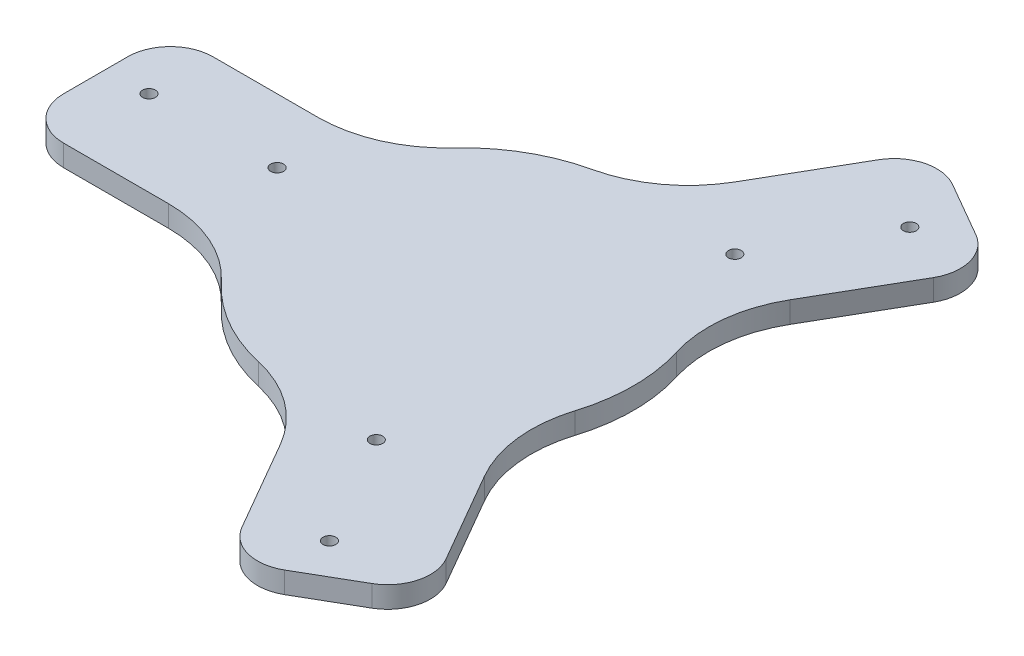
from build123d import *

# Parameters (mm, degrees)
ESQUISSE1_R        = 1.5
BOSS_EXTRU_1_DEPTH = 5


with BuildPart() as part:
    # Esquisse1 → Boss.-Extru.1 (new body)
    with BuildSketch(Plane(origin=(0, 0, 0), x_dir=(1, 0, 0), z_dir=(0, 1, 0))):
        with BuildLine():
            Line((40.864149318, 35.778782826), (53.139812779, 57.040855637))
            ThreePointArc((53.139812779, 57.040855637), (54.138817004, 64.629046088), (49.479558741, 70.701109675))
            Line((49.479558741, 70.701109675), (36.489177684, 78.201109675))
            ThreePointArc((36.489177684, 78.201109675), (28.900987233, 79.2001139), (22.828923646, 74.540855637))
            Line((22.828923646, 74.540855637), (10.553260185, 53.278782826))
            ThreePointArc((10.553260185, 53.278782826), (2.360755727, 44.121425984), (-8.815715388, 39.016447329))
            ThreePointArc((-8.815715388, 39.016447329), (-20, 34.641016151), (-29.381376859, 27.142857143))
            ThreePointArc((-29.381376859, 27.142857143), (-39.390653617, 20.016238561), (-51.417409503, 17.5))
            Line((-51.417409503, 17.5), (-75.968736425, 17.5))
            ThreePointArc((-75.968736425, 17.5), (-83.039804237, 14.571067812), (-85.968736425, 7.5))
            Line((-85.968736425, 7.5), (-85.968736425, -7.5))
            ThreePointArc((-85.968736425, -7.5), (-83.039804237, -14.571067812), (-75.968736425, -17.5))
            Line((-75.968736425, -17.5), (-51.417409503, -17.5))
            ThreePointArc((-51.417409503, -17.5), (-39.390653617, -20.016238561), (-29.381376859, -27.142857143))
            ThreePointArc((-29.381376859, -27.142857143), (-20, -34.641016151), (-8.815715388, -39.016447329))
            ThreePointArc((-8.815715388, -39.016447329), (2.360755727, -44.121425984), (10.553260185, -53.278782826))
            Line((10.553260185, -53.278782826), (22.828923646, -74.540855637))
            ThreePointArc((22.828923646, -74.540855637), (28.900987233, -79.2001139), (36.489177684, -78.201109675))
            Line((36.489177684, -78.201109675), (49.479558741, -70.701109675))
            ThreePointArc((49.479558741, -70.701109675), (54.138817004, -64.629046088), (53.139812779, -57.040855637))
            Line((53.139812779, -57.040855637), (40.864149318, -35.778782826))
            ThreePointArc((40.864149318, -35.778782826), (37.02989789, -24.105187424), (38.197092246, -11.873590187))
            ThreePointArc((38.197092246, -11.873590187), (40, 0), (38.197092246, 11.873590187))
            ThreePointArc((38.197092246, 11.873590187), (37.02989789, 24.105187424), (40.864149318, 35.778782826))
        make_face()
        with Locations(Location((-75.968736425, 2.5, 0), (0, 0, 270))):
            Circle(ESQUISSE1_R, mode=Mode.SUBTRACT)
        with Locations(Location((-45.968736425, 2.5, 0), (0, 0, 270))):
            Circle(ESQUISSE1_R, mode=Mode.SUBTRACT)
        with Locations(Location((40.149431722, 64.540855637, 0), (0, 0, 270))):
            Circle(ESQUISSE1_R, mode=Mode.SUBTRACT)
        with Locations(Location((25.149431722, 38.560093524, 0), (0, 0, 270))):
            Circle(ESQUISSE1_R, mode=Mode.SUBTRACT)
        with Locations(Location((35.819304703, -67.040855637, 0), (0, 0, 270))):
            Circle(ESQUISSE1_R, mode=Mode.SUBTRACT)
        with Locations(Location((20.819304703, -41.060093524, 0), (0, 0, 270))):
            Circle(ESQUISSE1_R, mode=Mode.SUBTRACT)
    extrude(amount=BOSS_EXTRU_1_DEPTH)


solid = part.part
